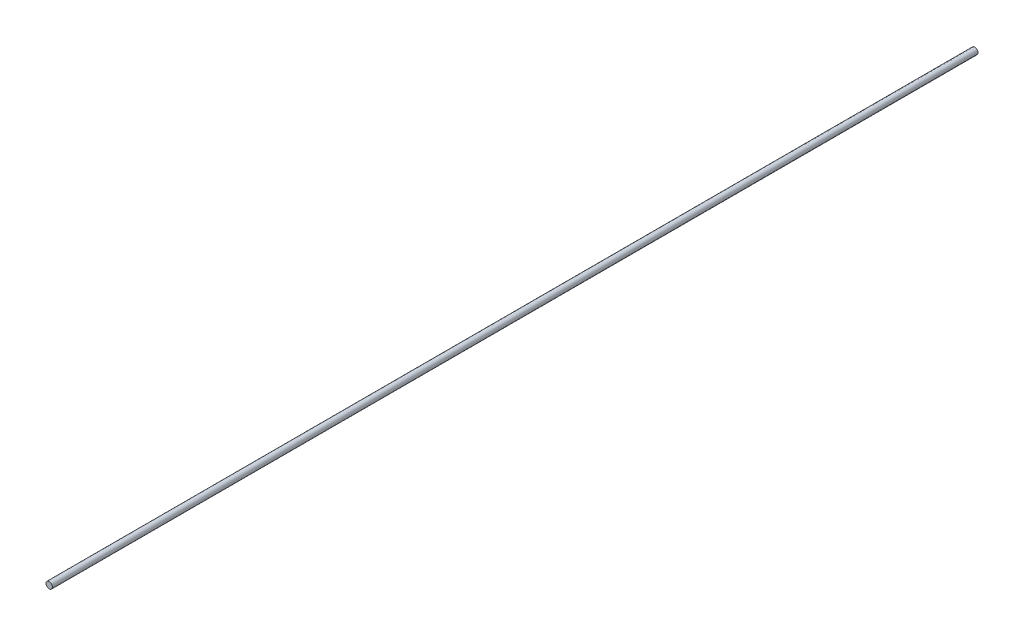
from build123d import *

# Parameters (mm, degrees)
SKETCH1_R           = 7.9375
BOSS_EXTRUDE1_DEPTH = 2286


with BuildPart() as part:
    # Sketch1 → Boss-Extrude1 (new body)
    with BuildSketch(Plane.XY):
        Circle(SKETCH1_R)
    extrude(amount=BOSS_EXTRUDE1_DEPTH)


solid = part.part
